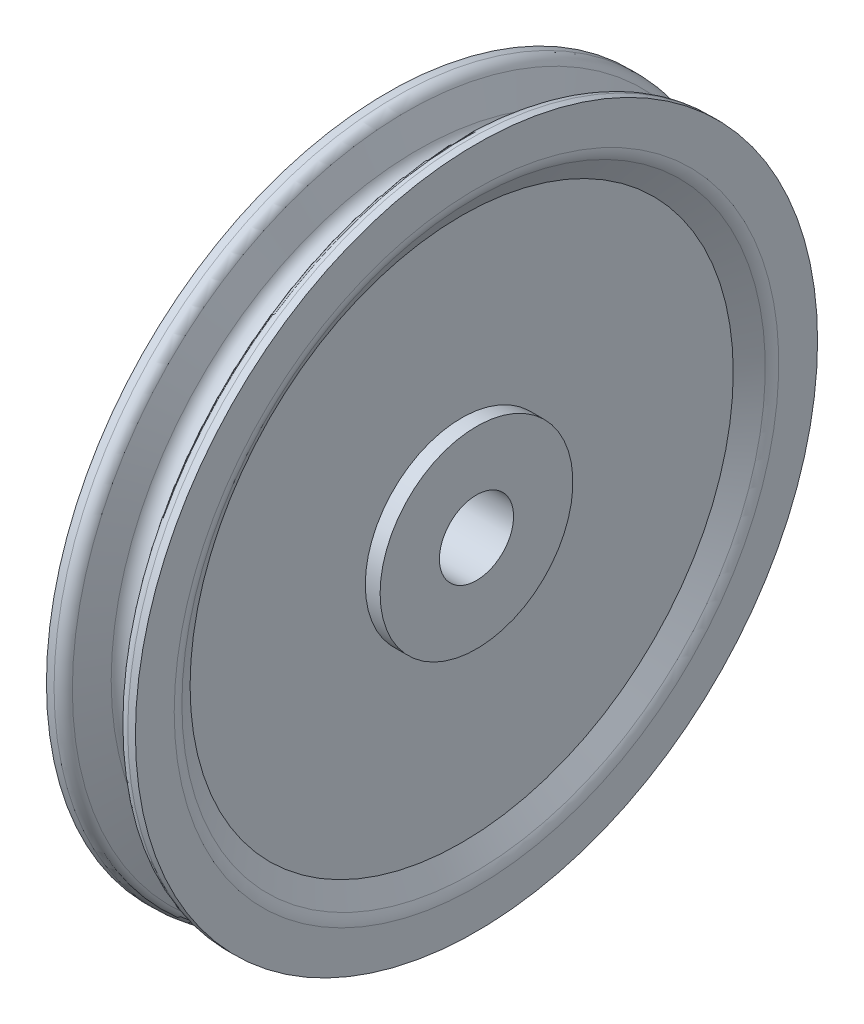
from build123d import *


with BuildPart() as part:
    # Sketch1 → Revolve-Thin2 (revolve)
    with BuildSketch(Plane.XY, mode=Mode.PRIVATE) as revolve_thin2_sk:
        with BuildLine():
            Line((15, 101.919552916), (15, 115))
            Line((15, 115), (12.427264768, 115))
            ThreePointArc((12.427264768, 115), (10.204983836, 114.325878449), (8.731746638, 112.530733729))
            Line((8.731746638, 112.530733729), (4.896561522, 103.271777808))
            ThreePointArc((4.896561522, 103.271777808), (0, 100), (-4.896561522, 103.271777808))
            Line((-4.896561522, 103.271777808), (-8.731746638, 112.530733729))
            ThreePointArc((-8.731746638, 112.530733729), (-10.204983836, 114.325878449), (-12.427264768, 115))
            Line((-12.427264768, 115), (-15, 115))
            Line((-15, 115), (-15, 101.919552916))
            ThreePointArc((-15, 101.919552916), (-14.750779031, 100.068341834), (-14.020862151, 98.348948072))
            Line((-14.020862151, 98.348948072), (-10, 91.568848397))
            Line((-10, 91.568848397), (-10, 32.5))
            Line((-10, 32.5), (-15, 32.5))
            Line((-15, 32.5), (-15, 12.5))
            Line((-15, 12.5), (15, 12.5))
            Line((15, 12.5), (15, 32.5))
            Line((15, 32.5), (10, 32.5))
            Line((10, 32.5), (10, 91.568848397))
            Line((10, 91.568848397), (14.020862151, 98.348948072))
            ThreePointArc((14.020862151, 98.348948072), (14.750779031, 100.068341834), (15, 101.919552916))
        make_face()
        with BuildLine():
            Line((14.9, 101.919552916), (14.9, 114.9))
            Line((14.9, 114.9), (12.427264768, 114.9))
            ThreePointArc((12.427264768, 114.9), (10.260540859, 114.242731488), (8.824134591, 112.492465386))
            Line((8.824134591, 112.492465386), (4.988949476, 103.233509465))
            ThreePointArc((4.988949476, 103.233509465), (0, 99.9), (-4.988949476, 103.233509465))
            Line((-4.988949476, 103.233509465), (-8.824134591, 112.492465386))
            ThreePointArc((-8.824134591, 112.492465386), (-10.260540859, 114.242731488), (-12.427264768, 114.9))
            Line((-12.427264768, 114.9), (-14.9, 114.9))
            Line((-14.9, 114.9), (-14.9, 101.919552916))
            ThreePointArc((-14.9, 101.919552916), (-14.654339331, 100.094787706), (-13.934849835, 98.399956712))
            Line((-13.934849835, 98.399956712), (-9.9, 91.596270582))
            Line((-9.9, 91.596270582), (-9.9, 32.4))
            Line((-9.9, 32.4), (-14.9, 32.4))
            Line((-14.9, 32.4), (-14.9, 12.6))
            Line((-14.9, 12.6), (14.9, 12.6))
            Line((14.9, 12.6), (14.9, 32.4))
            Line((14.9, 32.4), (9.9, 32.4))
            Line((9.9, 32.4), (9.9, 91.596270582))
            Line((9.9, 91.596270582), (13.934849835, 98.399956712))
            ThreePointArc((13.934849835, 98.399956712), (14.654339331, 100.094787706), (14.9, 101.919552916))
        make_face(mode=Mode.SUBTRACT)
    revolve(revolve_thin2_sk.sketch.rotate(Axis((-36.211666464, 0, 0), (1, 0, 0)), 90), axis=Axis((-36.211666464, 0, 0), (1, 0, 0)))


solid = part.part
